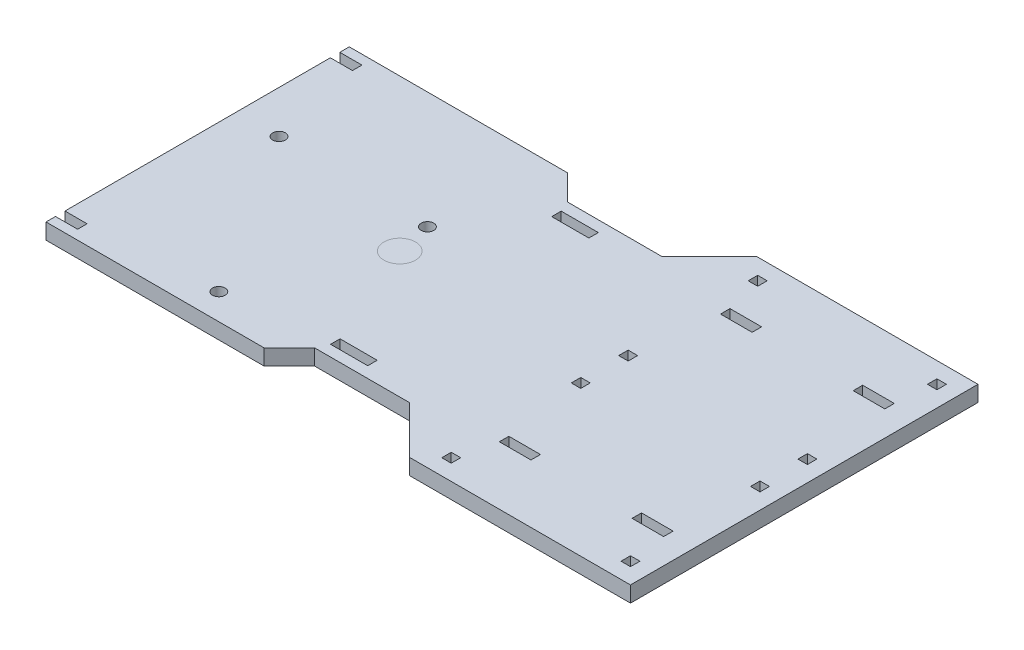
from build123d import *

# Parameters (mm, degrees)
BOSS_EXTRUDE1_DEPTH  = 5
SKETCH10_W           = 3
SKETCH10_H           = 3
CUT_EXTRUDE3_DEPTH   = 10
SKETCH11_W           = 10
SKETCH11_H           = 3
CUT_EXTRUDE4_DEPTH   = 10
BOSS_EXTRUDE5_DEPTH  = 3
SKETCH13_R           = 2
BOSS_EXTRUDE6_DEPTH  = 3
SKETCH14_R           = 2
SKETCH14_W           = 7
SKETCH14_H           = 3
BOSS_EXTRUDE7_DEPTH  = 3
SKETCH15_W           = 11.761480784
SKETCH15_H           = 3
BOSS_EXTRUDE8_DEPTH  = 3
SKETCH15_3_W         = 11.761480784
SKETCH15_3_H         = 3
CUT_EXTRUDE6_DEPTH   = 3
CUT_EXTRUDE7_DEPTH   = 63
BOSS_EXTRUDE9_DEPTH  = 3
BOSS_EXTRUDE10_DEPTH = 5
SKETCH19_R           = 2
CUT_EXTRUDE8_DEPTH   = 10
SKETCH24_R           = 1.75
CUT_EXTRUDE12_DEPTH  = 3
BOSS_EXTRUDE12_DEPTH = 3
CUT_EXTRUDE13_DEPTH  = 3
SKETCH27_R           = 2
CUT_EXTRUDE14_DEPTH  = 3
SKETCH29_W           = 25
SKETCH29_H           = 120
BOSS_EXTRUDE13_DEPTH = 1.4
SKETCH30_R           = 2
CUT_EXTRUDE15_DEPTH  = 30.4


with BuildPart() as part:
    # Sketch1 → Boss-Extrude1 (new body)
    with BuildSketch(Plane(origin=(0, 0, 0), x_dir=(1, 0, 0), z_dir=(0, 1, 0))):
        Polygon((-70, -55), (0, -55), (0, 55), (-70, 55), (-85, 40), (-210, 40), (-250, 0), (-210, -40), (-85, -40), align=None)
    extrude(amount=-BOSS_EXTRUDE1_DEPTH)

    # Sketch10 → Cut-Extrude3 (cut)
    with BuildSketch(Plane(origin=(0, 0, 0), x_dir=(1, 0, 0), z_dir=(0, 1, 0))):
        with Locations((-63.236231, -7.5)):
            Rectangle(SKETCH10_W, SKETCH10_H)
        with Locations((-63.236231, -48.5)):
            Rectangle(SKETCH10_W, SKETCH10_H)
        with Locations((-6.5, -48.5)):
            Rectangle(SKETCH10_W, SKETCH10_H)
        with Locations((-6.5, -7.5)):
            Rectangle(SKETCH10_W, SKETCH10_H)
        with Locations((-6.5, 7.5)):
            Rectangle(SKETCH10_W, SKETCH10_H)
        with Locations((-6.5, 48.5)):
            Rectangle(SKETCH10_W, SKETCH10_H)
        with Locations((-63.236231, 48.5)):
            Rectangle(SKETCH10_W, SKETCH10_H)
        with Locations((-63.236231, 7.5)):
            Rectangle(SKETCH10_W, SKETCH10_H)
    extrude(amount=-CUT_EXTRUDE3_DEPTH, mode=Mode.SUBTRACT)

    # Sketch11 → Cut-Extrude4 (cut)
    with BuildSketch(Plane(origin=(0, 0, 0), x_dir=(1, 0, 0), z_dir=(0, 1, 0))):
        with Locations((-13, -35)):
            Rectangle(SKETCH11_W, SKETCH11_H)
        with Locations((-13, 35)):
            Rectangle(SKETCH11_W, SKETCH11_H)
        with Locations((-55, 35)):
            Rectangle(SKETCH11_W, SKETCH11_H)
        with Locations((-55, -35)):
            Rectangle(SKETCH11_W, SKETCH11_H)
    extrude(amount=-CUT_EXTRUDE4_DEPTH, mode=Mode.SUBTRACT)

    # Sketch15<3> → Cut-Extrude6 (cut)
    # profile 1 of 2: a face of its own
    with BuildSketch(Plane(origin=(0, 0, -33.5), x_dir=(-1, 0, 0), z_dir=(0, 0, -1))):
        Polygon((97.670134296, 0), (117.43161508, 0), (117.43161508, 17.663270368), (97.670134296, 22.958343186), align=None)
        Polygon((112.655157945, 10.660908757), (113.43161508, 13.558686236), (106.670134296, 15.370419552), (100.874579339, 16.923333822), (100.098122203, 14.025556343), (105.893677161, 12.472642073), align=None, mode=Mode.SUBTRACT)
    # profile 2 of 2: a face of its own
    with BuildSketch(Plane(origin=(0, 0, -33.5), x_dir=(-1, 0, 0), z_dir=(0, 0, -1))):
        with Locations((107.550874688, -1.5)):
            Rectangle(SKETCH15_3_W, SKETCH15_3_H)
    cut_extrude6 = extrude(amount=CUT_EXTRUDE6_DEPTH, mode=Mode.SUBTRACT)

    # Mirror5: Cut-Extrude6 across plane
    add(cut_extrude6.mirror(Plane.XY), mode=Mode.SUBTRACT)

    # Sketch17 → Cut-Extrude7 (cut)
    with BuildSketch(Plane(origin=(0, 0, 0), x_dir=(1, 0, 0), z_dir=(0, 1, 0))):
        Polygon((-192, -40), (-192, 40), (-210, 40), (-250, 0), (-210, -40), align=None)
    extrude(amount=-CUT_EXTRUDE7_DEPTH, mode=Mode.SUBTRACT)

    # Sketch20 → Boss-Extrude10 (add)
    with BuildSketch(Plane(origin=(0, 0, 0), x_dir=(1, 0, 0), z_dir=(0, 1, 0))):
        Polygon((-115, -40), (-192, -40), (-192, -48), (-123, -48), align=None)
        Polygon((-192, 48), (-192, 40), (-115, 40), (-123, 48), align=None)
    extrude(amount=-BOSS_EXTRUDE10_DEPTH)

    # Sketch19 → Cut-Extrude8 (cut)
    with BuildSketch(Plane(origin=(0, 0, 0), x_dir=(1, 0, 0), z_dir=(0, 1, 0))):
        with Locations(Location((-130.301621673, 11.049999775, 0), (0, 0, 270))):
            Circle(SKETCH19_R)
        with Locations(Location((-178.561621814, 12.319994418, 0), (0, 0, 270))):
            Circle(SKETCH19_R)
        with Locations(Location((-145.541616034, -39.750001917, 0), (0, 0, 270))):
            Circle(SKETCH19_R)
    extrude(amount=-CUT_EXTRUDE8_DEPTH, mode=Mode.SUBTRACT)


with BuildPart() as body_2:
    # Sketch12 → Boss-Extrude5 (new body)
    with BuildSketch(Plane.XY.offset(-36.5)):
        Polygon((-67, 0), (-2, 0), (3.967923412, 30), (15.016198358, 63.505316822), (-12, 56.26634829), (-67, 29.176380902), align=None)
        Polygon((-4.577717242, 39.620171714), (-5.354174377, 42.517949192), (1.407306407, 44.329682508), (2.183763542, 41.431905029), align=None, mode=Mode.SUBTRACT)
    extrude(amount=BOSS_EXTRUDE5_DEPTH)


with BuildPart() as body_3:
    # Mirror3: mirrored copy
    add(body_2.part.mirror(Plane.XY))


with BuildPart() as body_4:
    # Sketch13 → Boss-Extrude6 (new body)
    with BuildSketch(Plane(origin=(-10.211691838, 38.11055277, 0), x_dir=(0.9659258262890699, 0.25881904510251513, 0), z_dir=(-0.25881904510251513, 0.9659258262890699, 0))):
        Polygon((12.8327197, 33.5), (12.8327197, 36.5), (5.8327197, 36.5), (5.8327197, 33.5), (4.8327197, 33.5), (4.8327197, -33.5), (5.8327197, -33.5), (5.8327197, -36.5), (12.8327197, -36.5), (12.8327197, -33.5), (18.8327197, -33.5), (18.8327197, 33.5), align=None)
        with Locations((13.8327197, -25.24)):
            Circle(SKETCH13_R, mode=Mode.SUBTRACT)
        with Locations((13.8327197, 25.24)):
            Circle(SKETCH13_R, mode=Mode.SUBTRACT)
    extrude(amount=BOSS_EXTRUDE6_DEPTH)


with BuildPart() as body_5:
    # Sketch14 → Boss-Extrude7 (new body)
    # profile 1 of 4: a face of its own
    with BuildSketch(Plane(origin=(-10.988148973, 41.008330249, 0), x_dir=(0.9659258262890699, 0.2588190451025152, 0), z_dir=(-0.2588190451025152, 0.9659258262890699, 0))):
        Polygon((-106.0572803, 33.5), (-107.0572803, 33.5), (-107.0572803, 0), (-93.0572803, 0), (-93.0572803, 33.5), (-99.0572803, 33.5), align=None)
        with Locations(Location((-102.0572803, 25.24, 0), (0, 0, 180))):
            Circle(SKETCH14_R, mode=Mode.SUBTRACT)
    # profile 2 of 4: a face of its own
    with BuildSketch(Plane(origin=(-10.988148973, 41.008330249, 0), x_dir=(0.9659258262890699, 0.2588190451025152, 0), z_dir=(-0.2588190451025152, 0.9659258262890699, 0))):
        with Locations((-102.5572803, 35)):
            Rectangle(SKETCH14_W, SKETCH14_H)
    # profile 3 of 4: a face of its own
    with BuildSketch(Plane(origin=(-10.988148973, 41.008330249, 0), x_dir=(0.9659258262890699, 0.2588190451025152, 0), z_dir=(-0.2588190451025152, 0.9659258262890699, 0))):
        Polygon((-93.0572803, 0), (-107.0572803, 0), (-107.0572803, -33.5), (-106.0572803, -33.5), (-99.0572803, -33.5), (-93.0572803, -33.5), align=None)
        with Locations(Location((-102.0572803, -25.24, 0), (0, 0, 180))):
            Circle(SKETCH14_R, mode=Mode.SUBTRACT)
    # profile 4 of 4: a face of its own
    with BuildSketch(Plane(origin=(-10.988148973, 41.008330249, 0), x_dir=(0.9659258262890699, 0.2588190451025152, 0), z_dir=(-0.2588190451025152, 0.9659258262890699, 0))):
        with Locations((-102.5572803, -35)):
            Rectangle(SKETCH14_W, SKETCH14_H)
    extrude(amount=-BOSS_EXTRUDE7_DEPTH)


with BuildPart() as body_6:
    # Sketch15 → Boss-Extrude8 (new body)
    # profile 1 of 3: a face of its own
    with BuildSketch(Plane(origin=(0, 0, -33.5), x_dir=(-1, 0, 0), z_dir=(0, 0, -1))):
        Polygon((97.670134296, 0), (117.43161508, 0), (117.43161508, 17.663270368), (97.670134296, 22.958343186), align=None)
        Polygon((112.655157945, 10.660908757), (113.43161508, 13.558686236), (106.670134296, 15.370419552), (100.874579339, 16.923333822), (100.098122203, 14.025556343), (105.893677161, 12.472642073), align=None, mode=Mode.SUBTRACT)
    # profile 2 of 3: a face of its own
    with BuildSketch(Plane(origin=(0, 0, -33.5), x_dir=(-1, 0, 0), z_dir=(0, 0, -1))):
        with Locations((107.550874688, -1.5)):
            Rectangle(SKETCH15_W, SKETCH15_H)
    # profile 3 of 3: a face of its own
    with BuildSketch(Plane(origin=(0, 0, -33.5), x_dir=(-1, 0, 0), z_dir=(0, 0, -1))):
        Polygon((105.893677161, 12.472642073), (106.670134296, 15.370419552), (100.874579339, 16.923333822), (100.098122203, 14.025556343), align=None)
    extrude(amount=BOSS_EXTRUDE8_DEPTH)


with BuildPart() as body_7:
    # Mirror4: mirrored copy
    add(body_6.part.mirror(Plane.XY))


with BuildPart() as body_8:
    # Sketch18 → Boss-Extrude9 (new body)
    with BuildSketch(Plane(origin=(-12.861561237, -48, 0), x_dir=(0, 0, 1), z_dir=(-0.25881904510252135, -0.9659258262890681, 0))):
        Polygon((48, 185.957758648), (-48, 185.957758648), (-48, 215.180976351), (0, 255.457758648), (48, 215.180976351), align=None)
    extrude(amount=BOSS_EXTRUDE9_DEPTH)

    # Sketch24 → Cut-Extrude12 (cut)
    with BuildSketch(Plane(origin=(-12.861561237, -48, 0), x_dir=(0.9659258262890682, -0.25881904510252135, 0), z_dir=(0.2588190451025213, 0.9659258262890681, 0))):
        with Locations(Location((-200.957758648, -13.875, 0), (0, 0, 180))):
            Circle(SKETCH24_R)
        with Locations(Location((-200.957758648, 13.875, 0), (0, 0, 180))):
            Circle(SKETCH24_R)
    extrude(amount=-CUT_EXTRUDE12_DEPTH, mode=Mode.SUBTRACT)


with BuildPart() as body_9:
    # Sketch26 → Boss-Extrude12 (new body)
    with BuildSketch(Plane.XY.offset(45)):
        Polygon((-172, 3), (-183.927615219, 13.636723728), (-191.439047106, 0), (-185, 0), (-172, 0), align=None)
        Polygon((-210.806452543, 8.145002313), (-211.582909679, 5.247224834), (-199.244443697, 1.941142838), (-192.482962913, 0.129409523), (-193.259420048, -2.768367956), (-200.020900832, -0.956634641), (-212.359366814, 2.349447355), (-213.135823949, -0.548330124), (-196.881901916, -9.881299392), (-192, -1.018389004), (-192, 0), (-191.439047106, 0), (-183.927615219, 13.636723728), align=None)
        Polygon((-192, -1.018389004), (-196.881901916, -9.881299392), (-172, -8), (-172, -5), (-185, -5), (-192, -5), align=None)
        Polygon((-185, 0), (-191.439047106, 0), (-192, -1.018389004), (-192, -5), (-185, -5), align=None)
        Polygon((-192.482962913, 0.129409523), (-199.244443697, 1.941142838), (-200.020900832, -0.956634641), (-193.259420048, -2.768367956), align=None)
        Polygon((-192, -1.018389004), (-191.439047106, 0), (-192, 0), align=None)
    extrude(amount=-BOSS_EXTRUDE12_DEPTH)


with BuildPart() as cut_extrude13_tool:
    # Sketch26<3> → Cut-Extrude13 (new body)
    with BuildSketch(Plane.XY.offset(45)):
        Polygon((-192.482962913, 0.129409523), (-199.244443697, 1.941142838), (-200.020900832, -0.956634641), (-193.259420048, -2.768367956), align=None)
        Polygon((-185, 0), (-191.439047106, 0), (-192, -1.018389004), (-192, -5), (-185, -5), align=None)
        Polygon((-192, -1.018389004), (-191.439047106, 0), (-192, 0), align=None)
    cut_extrude13 = extrude(amount=-CUT_EXTRUDE13_DEPTH)


with BuildPart() as body_8_1:
    add(body_8.part)

    # Cut-Extrude13: cut by cut_extrude13_tool
    add(cut_extrude13_tool.part, mode=Mode.SUBTRACT)


with BuildPart() as part_1:
    add(part.part)

    # Cut-Extrude13: cut by cut_extrude13_tool
    add(cut_extrude13_tool.part, mode=Mode.SUBTRACT)


with BuildPart() as body_10:
    # Mirror7: mirrored copy
    add(body_9.part.mirror(Plane.XY))


with BuildPart() as mirror8_tool:
    # Mirror8: Cut-Extrude13 across plane
    add(cut_extrude13.mirror(Plane.XY))


with BuildPart() as body_8_2:
    add(body_8_1.part)

    # Mirror8: cut by mirror8_tool
    add(mirror8_tool.part, mode=Mode.SUBTRACT)

    # Sketch27 → Cut-Extrude14 (cut)
    with BuildSketch(Plane(origin=(-12.861561237, -48, 0), x_dir=(0.9659258262890681, -0.25881904510252146, 0), z_dir=(0.25881904510252146, 0.9659258262890681, 0))):
        with Locations(Location((-220.731478581, 30.495102239, 0), (0, 0, 180))):
            Circle(SKETCH27_R)
        with Locations(Location((-220.731478581, -30.495102239, 0), (0, 0, 180))):
            Circle(SKETCH27_R)
    extrude(amount=-CUT_EXTRUDE14_DEPTH, mode=Mode.SUBTRACT)


with BuildPart() as part_2:
    add(part_1.part)

    # Mirror8: cut by mirror8_tool
    add(mirror8_tool.part, mode=Mode.SUBTRACT)


with BuildPart() as body_11:
    # Sketch29 → Boss-Extrude13 (new body)
    with BuildSketch(Plane(origin=(-16.226208823, -60.557035742, 0), x_dir=(-0.9659258262890681, 0.25881904510252146, 0), z_dir=(-0.25881904510252146, -0.9659258262890681, 0))):
        with Locations((228.231478581, 0)):
            Rectangle(SKETCH29_W, SKETCH29_H)
    extrude(amount=BOSS_EXTRUDE13_DEPTH)

    # Sketch30 → Cut-Extrude15 (cut)
    with BuildSketch(Plane(origin=(-16.226208823, -60.557035742, 0), x_dir=(0.9659258262890681, -0.2588190451025215, 0), z_dir=(0.2588190451025215, 0.9659258262890681, 0))):
        with Locations(Location((-220.731478581, 30.495102239, 0), (0, 0, 180))):
            Circle(SKETCH30_R)
        with Locations(Location((-220.731478581, -30.495102239, 0), (0, 0, 180))):
            Circle(SKETCH30_R)
    extrude(amount=-CUT_EXTRUDE15_DEPTH, mode=Mode.SUBTRACT)


solid = part_2.part
